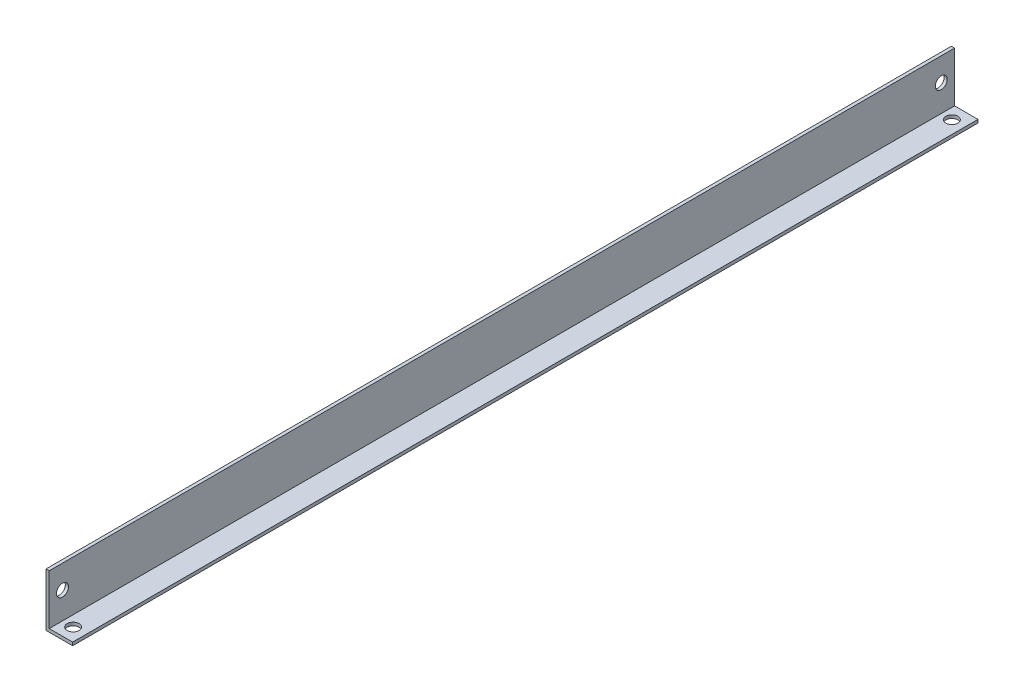
from build123d import *

# Parameters (mm, degrees)
EXTRUDE_1_DEPTH       = 340
HOLE_WIZARD_M41_D     = 4.5
HOLE_WIZARD_M41_DEPTH = 5
HOLE_WIZARD_M41_TIP   = 1.351936393
HOLE_WIZARD_M42_D     = 4.5
HOLE_WIZARD_M42_DEPTH = 5
HOLE_WIZARD_M42_TIP   = 1.351936393


with BuildPart() as part:
    # Эскиз1 → Бобышка-Вытянуть1 (new body)
    with BuildSketch(Plane.XY):
        Polygon((0, 0), (0, 20), (1.2, 20), (1.2, 1.2), (10, 1.2), (10, 0), align=None)
    extrude(amount=EXTRUDE_1_DEPTH)

    # Отверстие с зазором M41
    with Locations(Plane.ZY):
        with Locations((335, 11.2), (5, 11.2)):
            Hole(HOLE_WIZARD_M41_D / 2, depth=HOLE_WIZARD_M41_DEPTH)
            with Locations((0, 0, -(HOLE_WIZARD_M41_DEPTH + HOLE_WIZARD_M41_TIP / 2))):  # 118° drill point
                Cone(0, HOLE_WIZARD_M41_D / 2, HOLE_WIZARD_M41_TIP, mode=Mode.SUBTRACT)

    # Отверстие с зазором M42
    with Locations(Plane.XZ):
        with Locations((5.2, 5), (5.2, 335)):
            Hole(HOLE_WIZARD_M42_D / 2, depth=HOLE_WIZARD_M42_DEPTH)
            with Locations((0, 0, -(HOLE_WIZARD_M42_DEPTH + HOLE_WIZARD_M42_TIP / 2))):  # 118° drill point
                Cone(0, HOLE_WIZARD_M42_D / 2, HOLE_WIZARD_M42_TIP, mode=Mode.SUBTRACT)


solid = part.part
